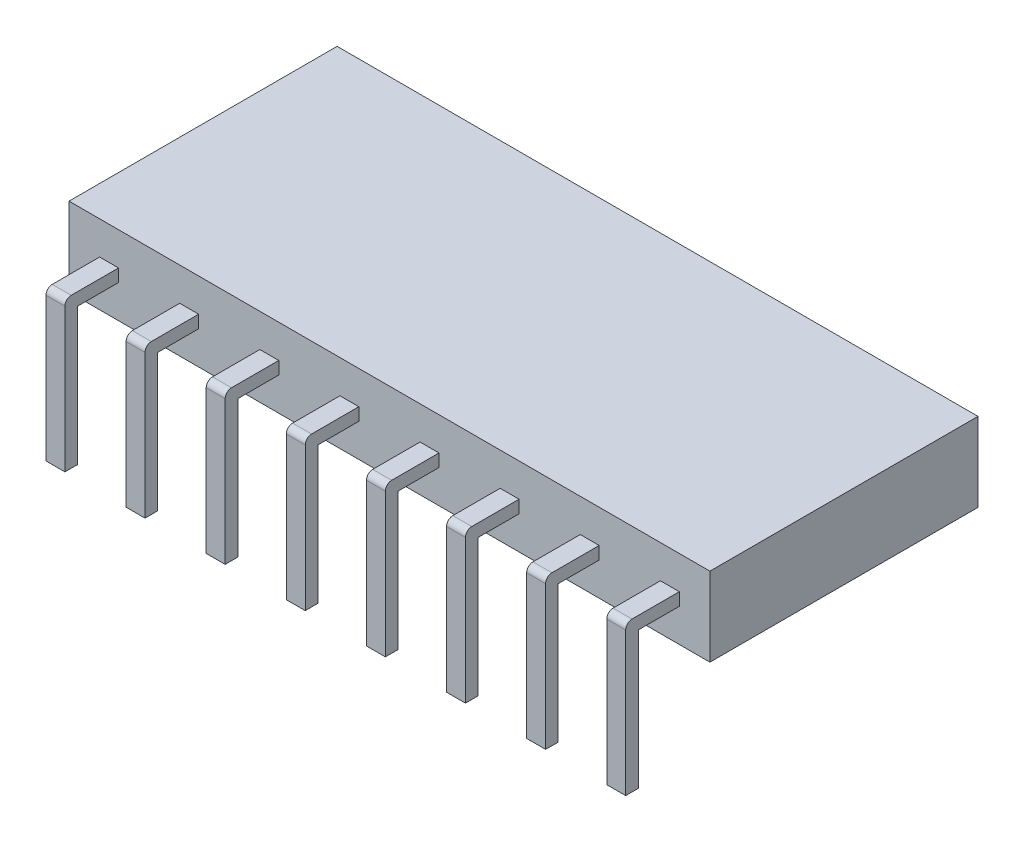
from build123d import *

# Parameters (mm, degrees)
SKETCH_1_W      = 20.32
SKETCH_1_H      = 8.5
EXTRUDE_1_DEPTH = 2.5
SKETCH_2_W      = 0.6
SKETCH_2_H      = 0.4
EXTRUDE_2_DEPTH = 1.7
SKETCH_3_W      = 0.6
SKETCH_3_H      = 0.4
EXTRUDE_3_DEPTH = 4.35
FILLET_1_R      = 0.2


with BuildPart() as part:
    # Эскиз1 → Бобышка-Вытянуть1 (new body)
    with BuildSketch(Plane(origin=(0, 0, 0), x_dir=(1, 0, 0), z_dir=(0, 1, 0))):
        Rectangle(SKETCH_1_W, SKETCH_1_H)
    extrude(amount=EXTRUDE_1_DEPTH)

    # Эскиз2 → Бобышка-Вытянуть2 (add)
    with BuildSketch(Plane.XY.offset(4.25)):
        with Locations((-6.35, 1.25)):
            Rectangle(SKETCH_2_W, SKETCH_2_H)
        with Locations((-8.89, 1.25)):
            Rectangle(SKETCH_2_W, SKETCH_2_H)
        with Locations((-3.81, 1.25)):
            Rectangle(SKETCH_2_W, SKETCH_2_H)
        with Locations((-1.27, 1.25)):
            Rectangle(SKETCH_2_W, SKETCH_2_H)
        with Locations((1.27, 1.25)):
            Rectangle(SKETCH_2_W, SKETCH_2_H)
        with Locations((3.81, 1.25)):
            Rectangle(SKETCH_2_W, SKETCH_2_H)
        with Locations((6.35, 1.25)):
            Rectangle(SKETCH_2_W, SKETCH_2_H)
        with Locations((8.89, 1.25)):
            Rectangle(SKETCH_2_W, SKETCH_2_H)
    extrude(amount=EXTRUDE_2_DEPTH)

    # Эскиз3 → Бобышка-Вытянуть3 (add)
    with BuildSketch(Plane.XZ.offset(-1.05)):
        with Locations((-8.89, 5.75)):
            Rectangle(SKETCH_3_W, SKETCH_3_H)
        with Locations((-6.35, 5.75)):
            Rectangle(SKETCH_3_W, SKETCH_3_H)
        with Locations((-3.81, 5.75)):
            Rectangle(SKETCH_3_W, SKETCH_3_H)
        with Locations((-1.27, 5.75)):
            Rectangle(SKETCH_3_W, SKETCH_3_H)
        with Locations((1.27, 5.75)):
            Rectangle(SKETCH_3_W, SKETCH_3_H)
        with Locations((3.81, 5.75)):
            Rectangle(SKETCH_3_W, SKETCH_3_H)
        with Locations((6.35, 5.75)):
            Rectangle(SKETCH_3_W, SKETCH_3_H)
        with Locations((8.89, 5.75)):
            Rectangle(SKETCH_3_W, SKETCH_3_H)
    extrude(amount=EXTRUDE_3_DEPTH)

    # Скругление1
    fillet_1_edges = [part.edges().sort_by_distance(p)[0] for p in [
        (-8.89, 1.45, 5.95),
        (-6.35, 1.45, 5.95),
        (-3.81, 1.45, 5.95),
        (-1.27, 1.45, 5.95),
        (1.27, 1.45, 5.95),
        (3.81, 1.45, 5.95),
        (6.35, 1.45, 5.95),
        (8.89, 1.45, 5.95),
    ]]
    fillet(fillet_1_edges, radius=FILLET_1_R)


solid = part.part
